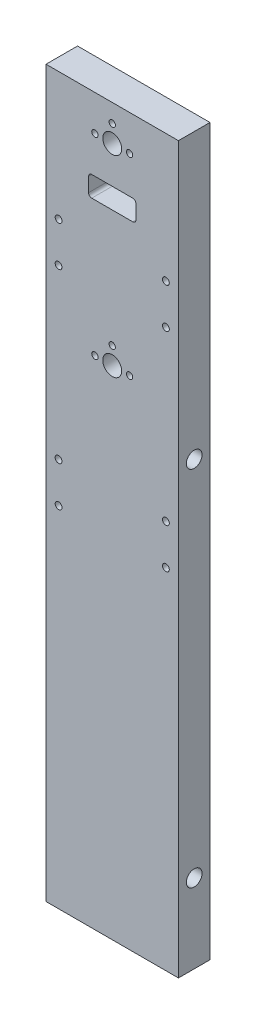
from build123d import *

# Parameters (mm, degrees)
SKETCH1_W           = 84
SKETCH1_H           = 460
SKETCH1_R           = 6
SKETCH1_R_2         = 2
BOSS_EXTRUDE1_DEPTH = 20
SKETCH2_R           = 5
CUT_EXTRUDE1_DEPTH  = 50
SKETCH4_R           = 2.159
CUT_EXTRUDE2_DEPTH  = 20
CUT_EXTRUDE3_DEPTH  = 20
SKETCH6_R           = 2.159
CUT_EXTRUDE4_DEPTH  = 20


with BuildPart() as part:
    # Sketch1 → Boss-Extrude1 (new body)
    with BuildSketch(Plane.XY):
        with Locations((0, -191.425)):
            Rectangle(SKETCH1_W, SKETCH1_H)
        with Locations((0, -106)):
            Circle(SKETCH1_R, mode=Mode.SUBTRACT)
        with Locations((11, -106)):
            Circle(SKETCH1_R_2, mode=Mode.SUBTRACT)
        with Locations((0, -95)):
            Circle(SKETCH1_R_2, mode=Mode.SUBTRACT)
        with Locations((0, 16)):
            Circle(SKETCH1_R, mode=Mode.SUBTRACT)
        with Locations((11, 16)):
            Circle(SKETCH1_R_2, mode=Mode.SUBTRACT)
        with Locations((-11, -106)):
            Circle(SKETCH1_R_2, mode=Mode.SUBTRACT)
        with Locations((0, 27)):
            Circle(SKETCH1_R_2, mode=Mode.SUBTRACT)
        with Locations((-11, 16)):
            Circle(SKETCH1_R_2, mode=Mode.SUBTRACT)
    extrude(amount=BOSS_EXTRUDE1_DEPTH)

    # Sketch2 → Cut-Extrude1 (cut, symmetric)
    with BuildSketch(Plane(origin=(0, 0, 0), x_dir=(0, 0, -1), z_dir=(1, 0, 0))):
        with Locations((-10, -141.425)):
            Circle(SKETCH2_R)
        with Locations((-10, -371.425)):
            Circle(SKETCH2_R)
    extrude(amount=CUT_EXTRUDE1_DEPTH, both=True, mode=Mode.SUBTRACT)

    # Sketch4 → Cut-Extrude2 (cut)
    with BuildSketch(Plane.XY):
        with Locations(Location((34.036, -42.557, 0), (0, 0, 180))):
            Circle(SKETCH4_R)
        with Locations(Location((34.036, -67.957, 0), (0, 0, 180))):
            Circle(SKETCH4_R)
        with Locations(Location((-34.036, -67.957, 0), (0, 0, 180))):
            Circle(SKETCH4_R)
        with Locations(Location((-34.036, -42.557, 0), (0, 0, 180))):
            Circle(SKETCH4_R)
    extrude(amount=CUT_EXTRUDE2_DEPTH, mode=Mode.SUBTRACT)

    # Sketch5 → Cut-Extrude3 (cut)
    with BuildSketch(Plane.XY):
        with BuildLine():
            Line((15, -18.4995), (15, -9.4995))
            ThreePointArc((15, -9.4995), (14.414213562, -8.085286438), (13, -7.4995))
            Line((13, -7.4995), (-13, -7.4995))
            ThreePointArc((-13, -7.4995), (-14.414213562, -8.085286438), (-15, -9.4995))
            Line((-15, -9.4995), (-15, -18.4995))
            ThreePointArc((-15, -18.4995), (-14.414213562, -19.913713562), (-13, -20.4995))
            Line((-13, -20.4995), (13, -20.4995))
            ThreePointArc((13, -20.4995), (14.414213562, -19.913713562), (15, -18.4995))
        make_face()
    extrude(amount=CUT_EXTRUDE3_DEPTH, mode=Mode.SUBTRACT)

    # Sketch6 → Cut-Extrude4 (cut)
    with BuildSketch(Plane.XY):
        with Locations((34.036, -174.558)):
            Circle(SKETCH6_R)
        with Locations((-34.036, -174.558)):
            Circle(SKETCH6_R)
        with Locations((-34.036, -199.958)):
            Circle(SKETCH6_R)
        with Locations((34.036, -199.958)):
            Circle(SKETCH6_R)
    extrude(amount=CUT_EXTRUDE4_DEPTH, mode=Mode.SUBTRACT)


solid = part.part
